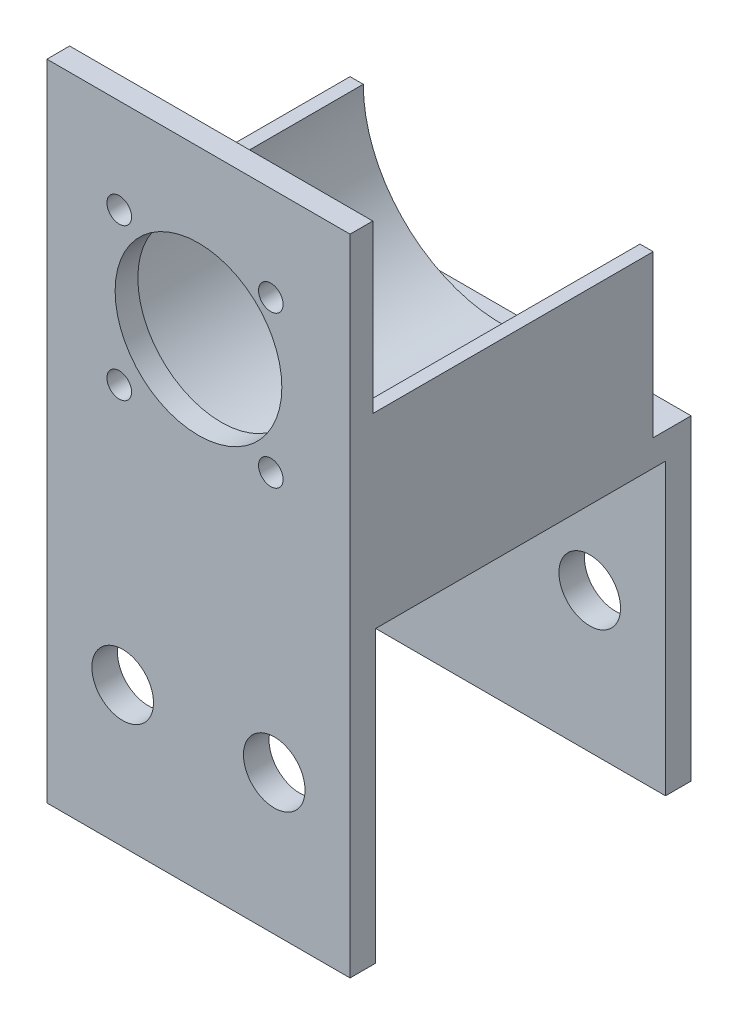
from build123d import *

# Parameters (mm, degrees)
ESQUISSE1_W                  = 40
ESQUISSE1_H                  = 85
BOSS_EXTRU_1_DEPTH           = 45
ESQUISSE2_W                  = 38.25
ESQUISSE2_H                  = 38.25
ENL_V_MAT_EXTRU_1_DEPTH      = 41.1
ESQUISSE3_W                  = 42
ESQUISSE3_H                  = 22
ENL_V_MAT_EXTRU_2_DEPTH      = 105.16333328
ESQUISSE4_R                  = 18.25625
ENL_V_MAT_EXTRU_3_DEPTH      = 42
ENL_V_MAT_EXTRU_4_DEPTH      = 104.048532255
ENL_V_MAT_EXTRU_4_DEPTH_BACK = 104.048532255
ESQUISSE5_R                  = 11
ESQUISSE6_R                  = 1.625
ENL_V_MAT_EXTRU_5_DEPTH      = 103.902866821
ENL_V_MAT_EXTRU_6_DEPTH      = 103.75038017
ENL_V_MAT_EXTRU_6_DEPTH_BACK = 103.75038017
ESQUISSE7_R                  = 4.065
ESQUISSE8_W                  = 5
ESQUISSE8_H                  = 21.25625
ENL_V_MAT_EXTRU_7_DEPTH      = 105.16333328


with BuildPart() as part:
    # Esquisse1 → Boss.-Extru.1 (new body)
    with BuildSketch(Plane.XY):
        with Locations((20, 42.5)):
            Rectangle(ESQUISSE1_W, ESQUISSE1_H)
    extrude(amount=BOSS_EXTRU_1_DEPTH)

    # Esquisse2 → Enlèv. mat.-Extru.1 (cut)
    with BuildSketch(Plane(origin=(40, 0, 0), x_dir=(0, 0, -1), z_dir=(1, 0, 0))):
        with Locations((-22.5, 19.125)):
            Rectangle(ESQUISSE2_W, ESQUISSE2_H)
    extrude(amount=-ENL_V_MAT_EXTRU_1_DEPTH, mode=Mode.SUBTRACT)

    # Esquisse3 → Enlèv. mat.-Extru.2 (cut, through all)
    with BuildSketch(Plane(origin=(0, 0, 45), x_dir=(0, 0, -1), z_dir=(1, 0, 0))):
        with Locations((24, 74)):
            Rectangle(ESQUISSE3_W, ESQUISSE3_H)
    extrude(amount=ENL_V_MAT_EXTRU_2_DEPTH, mode=Mode.SUBTRACT)

    # Esquisse4 → Enlèv. mat.-Extru.3 (cut)
    with BuildSketch(Plane.XY):
        with Locations((20, 63)):
            Circle(ESQUISSE4_R)
    extrude(amount=ENL_V_MAT_EXTRU_3_DEPTH, mode=Mode.SUBTRACT)

    # Esquisse5 → Enlèv. mat.-Extru.4 (cut, two sides: drawn at the far end of the back side and taken through both)
    with BuildSketch(Plane(origin=(37, 0, 0), x_dir=(-1, 0, 0), z_dir=(0, 0, -1)).offset(-ENL_V_MAT_EXTRU_4_DEPTH_BACK)):
        with Locations((17, 63)):
            Circle(ESQUISSE5_R)
    extrude(amount=ENL_V_MAT_EXTRU_4_DEPTH + ENL_V_MAT_EXTRU_4_DEPTH_BACK, mode=Mode.SUBTRACT)

    # Esquisse6 → Enlèv. mat.-Extru.5 (cut, through all)
    with BuildSketch(Plane(origin=(0, 0, 42), x_dir=(-1, 0, 0), z_dir=(0, 0, -1))):
        with Locations((-29.545941546, 72.545941546)):
            Circle(ESQUISSE6_R)
        with Locations((-29.545941546, 52.545941546)):
            Circle(ESQUISSE6_R)
        with Locations((-9.545941546, 52.545941546)):
            Circle(ESQUISSE6_R)
        with Locations((-9.545941546, 72.545941546)):
            Circle(ESQUISSE6_R)
    extrude(amount=-ENL_V_MAT_EXTRU_5_DEPTH, mode=Mode.SUBTRACT)

    # Esquisse7 → Enlèv. mat.-Extru.6 (cut, two sides: drawn at the far end of the back side and taken through both)
    with BuildSketch(Plane(origin=(0, 0, 41.625), x_dir=(-1, 0, 0), z_dir=(0, 0, -1)).offset(-ENL_V_MAT_EXTRU_6_DEPTH_BACK)):
        with Locations((-10, 18.4875)):
            Circle(ESQUISSE7_R)
        with Locations((-30, 18.4875)):
            Circle(ESQUISSE7_R)
    extrude(amount=ENL_V_MAT_EXTRU_6_DEPTH + ENL_V_MAT_EXTRU_6_DEPTH_BACK, mode=Mode.SUBTRACT)

    # Esquisse8 → Enlèv. mat.-Extru.7 (cut, through all)
    with BuildSketch(Plane.ZY):
        with Locations((2.5, 52.371875)):
            Rectangle(ESQUISSE8_W, ESQUISSE8_H)
    extrude(amount=-ENL_V_MAT_EXTRU_7_DEPTH, mode=Mode.SUBTRACT)


solid = part.part
